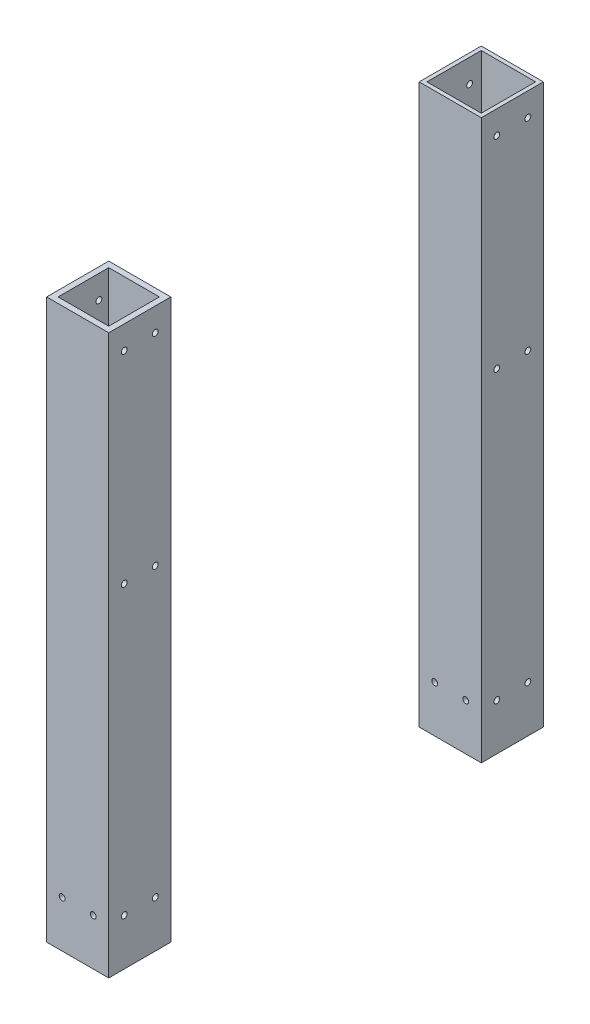
from build123d import *

# Parameters (mm, degrees)
SKETCH1_W             = 50.8
SKETCH1_H             = 50.8
SKETCH1_W_2           = 44.45
SKETCH1_H_2           = 44.45
BOSS_EXTRUDE2_DEPTH   = 457.2
SKETCH1_W_3           = 41.457352758
SKETCH1_H_3           = 41.457352758
BOSS_EXTRUDE2_2_DEPTH = 457.2
SKETCH3_R             = 2.413
CUT_EXTRUDE2_DEPTH    = 530.171164564
SKETCH4_R             = 2.413
CUT_EXTRUDE3_DEPTH    = 530.171164564
SKETCH2_R             = 2.413
CUT_EXTRUDE4_DEPTH    = 254


with BuildPart() as part:
    # Sketch1 → Boss-Extrude2 (new body)
    with BuildSketch(Plane(origin=(0, 0, 0), x_dir=(1, 0, 0), z_dir=(0, 1, 0))):
        with Locations((173.0375, 152.4)):
            Rectangle(SKETCH1_W, SKETCH1_H)
        with Locations((173.0375, 152.4)):
            Rectangle(SKETCH1_W_2, SKETCH1_H_2, mode=Mode.SUBTRACT)
    extrude(amount=BOSS_EXTRUDE2_DEPTH)


with BuildPart() as body_2:
    # Sketch1 → Boss-Extrude2 2 (new body)
    with BuildSketch(Plane(origin=(0, 0, 0), x_dir=(1, 0, 0), z_dir=(0, 1, 0))):
        with Locations((173.0375, -152.4)):
            Rectangle(SKETCH1_W, SKETCH1_H)
        with Locations((173.0375, -152.4)):
            Rectangle(SKETCH1_W_3, SKETCH1_H_3, mode=Mode.SUBTRACT)
    extrude(amount=BOSS_EXTRUDE2_2_DEPTH)


with BuildPart() as cut_extrude2_tool:
    # Sketch3 → Cut-Extrude2 (new, through all)
    with BuildSketch(Plane(origin=(0, 0, 0), x_dir=(0, 0, -1), z_dir=(1, 0, 0))):
        with Locations((-165.1, 438.15)):
            Circle(SKETCH3_R)
        with Locations((-165.1, 273.05)):
            Circle(SKETCH3_R)
        with Locations((-139.7, 273.05)):
            Circle(SKETCH3_R)
        with Locations((-139.7, 438.15)):
            Circle(SKETCH3_R)
        with Locations((139.7, 438.15)):
            Circle(SKETCH3_R)
        with Locations((139.7, 273.05)):
            Circle(SKETCH3_R)
        with Locations((165.1, 273.05)):
            Circle(SKETCH3_R)
        with Locations((165.1, 438.15)):
            Circle(SKETCH3_R)
    extrude(amount=CUT_EXTRUDE2_DEPTH)


with BuildPart() as part_1:
    add(part.part)

    # Cut-Extrude2: cut by cut_extrude2_tool
    add(cut_extrude2_tool.part, mode=Mode.SUBTRACT)


with BuildPart() as body_2_1:
    add(body_2.part)

    # Cut-Extrude2: cut by cut_extrude2_tool
    add(cut_extrude2_tool.part, mode=Mode.SUBTRACT)


with BuildPart() as cut_extrude3_tool:
    # Sketch4 → Cut-Extrude3 (new, through all)
    with BuildSketch(Plane(origin=(0, 0, 0), x_dir=(0, 0, -1), z_dir=(1, 0, 0))):
        with Locations((-165.1, 38.1)):
            Circle(SKETCH4_R)
        with Locations((-139.7, 38.1)):
            Circle(SKETCH4_R)
        with Locations((139.7, 38.1)):
            Circle(SKETCH4_R)
        with Locations((165.1, 38.1)):
            Circle(SKETCH4_R)
    extrude(amount=CUT_EXTRUDE3_DEPTH)


with BuildPart() as part_2:
    add(part_1.part)

    # Cut-Extrude3: cut by cut_extrude3_tool
    add(cut_extrude3_tool.part, mode=Mode.SUBTRACT)


with BuildPart() as body_2_2:
    add(body_2_1.part)

    # Cut-Extrude3: cut by cut_extrude3_tool
    add(cut_extrude3_tool.part, mode=Mode.SUBTRACT)


with BuildPart() as cut_extrude4_tool:
    # Sketch2 → Cut-Extrude4 (new, symmetric)
    with BuildSketch(Plane.XY):
        with Locations((185.7375, 38.1)):
            Circle(SKETCH2_R)
        with Locations((160.3375, 38.1)):
            Circle(SKETCH2_R)
    extrude(amount=CUT_EXTRUDE4_DEPTH, both=True)


with BuildPart() as part_3:
    add(part_2.part)

    # Cut-Extrude4: cut by cut_extrude4_tool
    add(cut_extrude4_tool.part, mode=Mode.SUBTRACT)


with BuildPart() as body_2_3:
    add(body_2_2.part)

    # Cut-Extrude4: cut by cut_extrude4_tool
    add(cut_extrude4_tool.part, mode=Mode.SUBTRACT)


solid = Compound([part_3.part, body_2_3.part])
